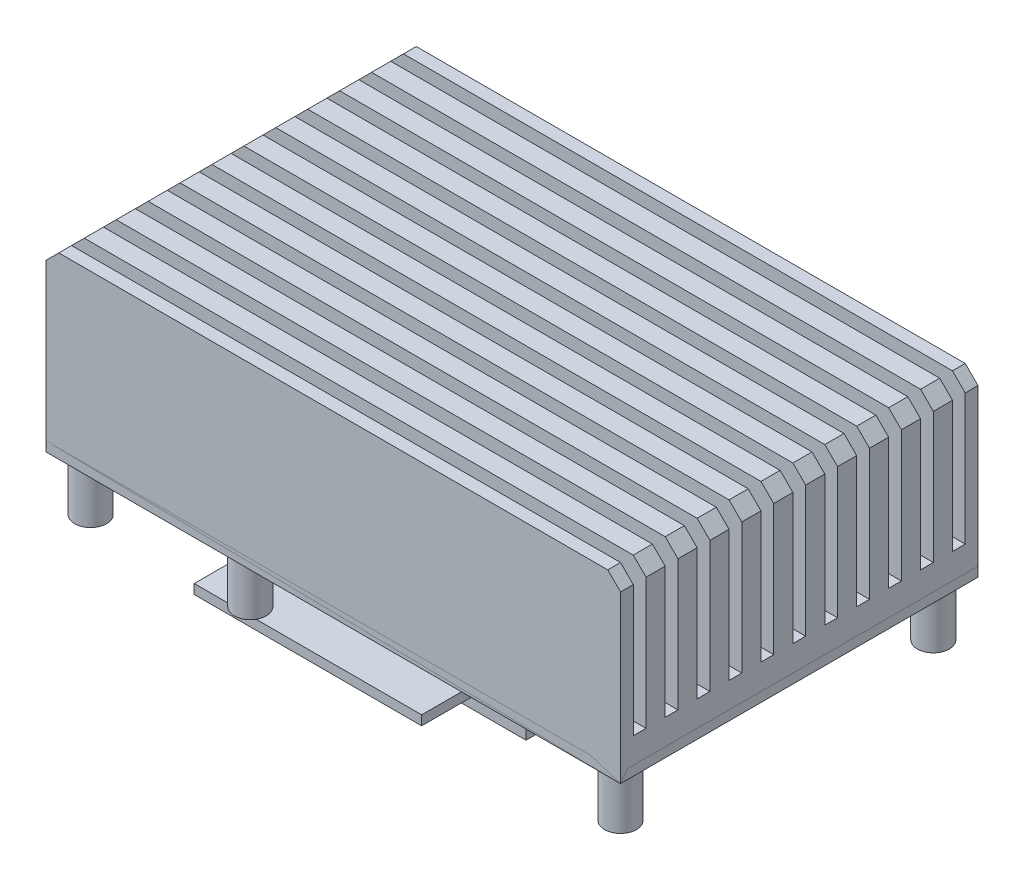
from build123d import *

# Parameters (mm, degrees)
SKETCH1_W             = 90
SKETCH1_H             = 56
BOSS_EXTRUDE1_DEPTH   = 1.5
SKETCH2_W             = 90
SKETCH2_H             = 56
BOSS_EXTRUDE2_DEPTH   = 28
CHAMFER1_SIZE         = 2
SKETCH3_W             = 2
SKETCH3_H             = 22.503636092
CUT_EXTRUDE1_DEPTH    = 60.941638283
LPATTERN1_COUNT       = 11
LPATTERN1_PITCH       = 5
SKETCH4_R             = 2.5
SKETCH4_R_2           = 1.5
BOSS_EXTRUDE3_DEPTH   = 8.5
BOSS_EXTRUDE3_2_DEPTH = 8.5
BOSS_EXTRUDE3_3_DEPTH = 8.5
BOSS_EXTRUDE3_4_DEPTH = 8.5
BOSS_EXTRUDE3_5_DEPTH = 8.5
BOSS_EXTRUDE3_6_DEPTH = 8.5
BOSS_EXTRUDE4_START   = -8.5
SKETCH6_W             = 35.624221149
SKETCH6_H             = 23.676807936
BOSS_EXTRUDE4_DEPTH   = 1.5
SKETCH7_W             = 31.961510529
SKETCH7_H             = 5.450462232
BOSS_EXTRUDE5_DEPTH   = 12
SKETCH5_W             = 14.5
SKETCH5_H             = 7
BOSS_EXTRUDE6_DEPTH   = 29
SKETCH5_W_2           = 18
SKETCH5_H_2           = 6.6
BOSS_EXTRUDE6_2_DEPTH = 29
SKETCH9_R             = 1.25
BOSS_EXTRUDE7_DEPTH   = 28.3
SKETCH9_R_2           = 1
BOSS_EXTRUDE7_2_DEPTH = 28.3


with BuildPart() as part:
    # Sketch1 → Boss-Extrude1 (new body)
    with BuildSketch(Plane(origin=(0, 0, 0), x_dir=(1, 0, 0), z_dir=(0, 1, 0))):
        Rectangle(SKETCH1_W, SKETCH1_H)
    extrude(amount=BOSS_EXTRUDE1_DEPTH)


with BuildPart() as body_2:
    # Sketch2 → Boss-Extrude2 (new body)
    with BuildSketch(Plane(origin=(0, 0, 0), x_dir=(1, 0, 0), z_dir=(0, 1, 0))):
        Rectangle(SKETCH2_W, SKETCH2_H)
    extrude(amount=BOSS_EXTRUDE2_DEPTH)

    # Chamfer1
    chamfer1_edges = [body_2.edges().sort_by_distance(p)[0] for p in [
        (45, 28, 0),
        (-45, 28, 0),
    ]]
    chamfer(chamfer1_edges, length=CHAMFER1_SIZE)

    # Sketch3 → Cut-Extrude1 (cut, symmetric)
    with BuildSketch(Plane(origin=(0, 0, 0), x_dir=(0, 0, -1), z_dir=(1, 0, 0))):
        with Locations((-25, 16.748181954)):
            Rectangle(SKETCH3_W, SKETCH3_H)
    cut_extrude1 = extrude(amount=CUT_EXTRUDE1_DEPTH, both=True, mode=Mode.SUBTRACT)

    # LPattern1: Cut-Extrude1 ×11
    with Locations(*[(0, 0, -i * LPATTERN1_PITCH) for i in range(1, LPATTERN1_COUNT)]):
        add(cut_extrude1, mode=Mode.SUBTRACT)


with BuildPart() as body_3:
    # Sketch4 → Boss-Extrude3 (new body)
    with BuildSketch(Plane.XZ):
        with Locations(Location((-41.5, 24.5, 0), (0, 0, 270))):
            Circle(SKETCH4_R)
        with Locations(Location((-41.5, 24.5, 0), (0, 0, 270))):
            Circle(SKETCH4_R_2, mode=Mode.SUBTRACT)
    extrude(amount=BOSS_EXTRUDE3_DEPTH)


with BuildPart() as body_4:
    # Sketch4 → Boss-Extrude3 2 (new body)
    with BuildSketch(Plane.XZ):
        with Locations(Location((-16.5, 24.5, 0), (0, 0, 270))):
            Circle(SKETCH4_R)
        with Locations(Location((-16.5, 24.5, 0), (0, 0, 270))):
            Circle(SKETCH4_R_2, mode=Mode.SUBTRACT)
    extrude(amount=BOSS_EXTRUDE3_2_DEPTH)


with BuildPart() as body_5:
    # Sketch4 → Boss-Extrude3 3 (new body)
    with BuildSketch(Plane.XZ):
        with Locations(Location((41.5, 24.5, 0), (0, 0, 270))):
            Circle(SKETCH4_R)
        with Locations(Location((41.5, 24.5, 0), (0, 0, 270))):
            Circle(SKETCH4_R_2, mode=Mode.SUBTRACT)
    extrude(amount=BOSS_EXTRUDE3_3_DEPTH)


with BuildPart() as body_6:
    # Sketch4 → Boss-Extrude3 4 (new body)
    with BuildSketch(Plane.XZ):
        with Locations(Location((-41.5, -24.5, 0), (0, 0, 270))):
            Circle(SKETCH4_R)
        with Locations(Location((-41.5, -24.5, 0), (0, 0, 270))):
            Circle(SKETCH4_R_2, mode=Mode.SUBTRACT)
    extrude(amount=BOSS_EXTRUDE3_4_DEPTH)


with BuildPart() as body_7:
    # Sketch4 → Boss-Extrude3 5 (new body)
    with BuildSketch(Plane.XZ):
        with Locations(Location((-16.5, -24.5, 0), (0, 0, 270))):
            Circle(SKETCH4_R)
        with Locations(Location((-16.5, -24.5, 0), (0, 0, 270))):
            Circle(SKETCH4_R_2, mode=Mode.SUBTRACT)
    extrude(amount=BOSS_EXTRUDE3_5_DEPTH)


with BuildPart() as body_8:
    # Sketch4 → Boss-Extrude3 6 (new body)
    with BuildSketch(Plane.XZ):
        with Locations(Location((41.5, -24.5, 0), (0, 0, 270))):
            Circle(SKETCH4_R)
        with Locations(Location((41.5, -24.5, 0), (0, 0, 270))):
            Circle(SKETCH4_R_2, mode=Mode.SUBTRACT)
    extrude(amount=BOSS_EXTRUDE3_6_DEPTH)


with BuildPart() as body_9:
    # Sketch6 → Boss-Extrude4 (new body)
    with BuildSketch(Plane(origin=(0, 0, 0), x_dir=(1, 0, 0), z_dir=(0, 1, 0)).offset(BOSS_EXTRUDE4_START)):
        with Locations((-6.223720435, -13.905640845)):
            Rectangle(SKETCH6_W, SKETCH6_H)
    extrude(amount=-BOSS_EXTRUDE4_DEPTH)


with BuildPart() as body_10:
    # Sketch7 → Boss-Extrude5 (new body)
    with BuildSketch(Plane.XZ.offset(10)):
        with Locations((-6.267324133, 4.792467993)):
            Rectangle(SKETCH7_W, SKETCH7_H)
    extrude(amount=BOSS_EXTRUDE5_DEPTH)


with BuildPart() as body_11:
    # Sketch5 → Boss-Extrude6 (new body)
    with BuildSketch(Plane.XY):
        with Locations((-7.25, 5)):
            Rectangle(SKETCH5_W, SKETCH5_H)
    extrude(amount=-BOSS_EXTRUDE6_DEPTH)


with BuildPart() as body_12:
    # Sketch5 → Boss-Extrude6 2 (new body)
    with BuildSketch(Plane.XY):
        with Locations((11.8, 4.8)):
            Rectangle(SKETCH5_W_2, SKETCH5_H_2)
    extrude(amount=-BOSS_EXTRUDE6_2_DEPTH)


with BuildPart() as body_13:
    # Sketch9 → Boss-Extrude7 (new body)
    with BuildSketch(Plane.XY):
        with Locations((36.5, 3.5)):
            Circle(SKETCH9_R)
    extrude(amount=-BOSS_EXTRUDE7_DEPTH)


with BuildPart() as body_14:
    # Sketch9 → Boss-Extrude7 2 (new body)
    with BuildSketch(Plane.XY):
        with Locations((-36.5, 2)):
            Circle(SKETCH9_R_2)
    extrude(amount=-BOSS_EXTRUDE7_2_DEPTH)


solid = Compound([part.part, body_2.part, body_3.part, body_4.part, body_5.part, body_6.part, body_7.part, body_8.part, body_9.part, body_10.part, body_11.part, body_12.part, body_13.part, body_14.part])
